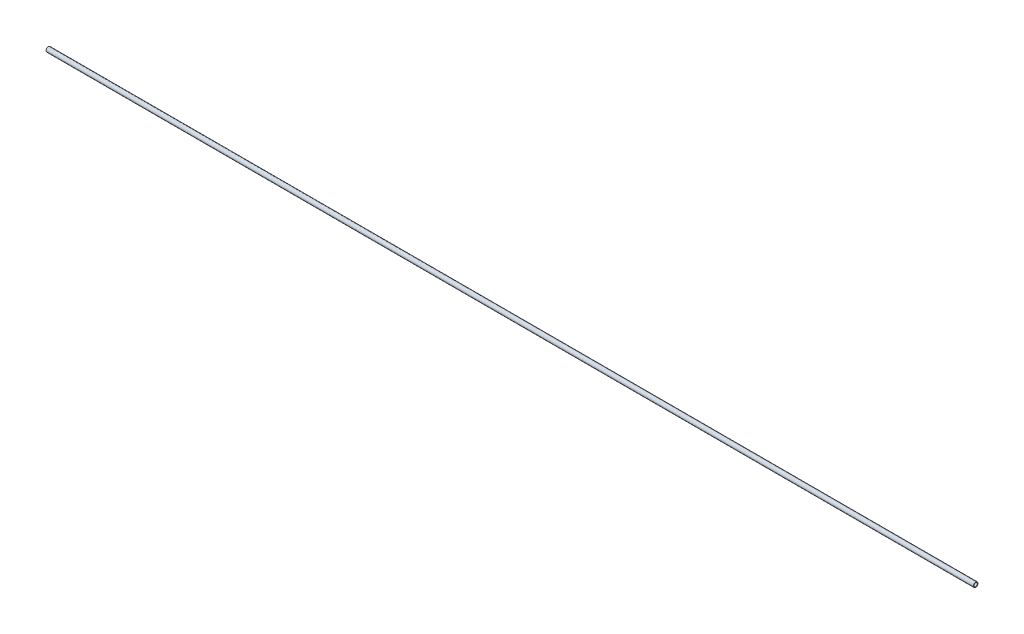
from build123d import *

# Parameters (mm, degrees)
SKETCH1_R           = 12.7
SKETCH1_R_2         = 9.652
BOSS_EXTRUDE1_DEPTH = 5080


with BuildPart() as part:
    # Sketch1 → Boss-Extrude1 (new body)
    with BuildSketch(Plane(origin=(0, 0, 0), x_dir=(0, 0, -1), z_dir=(1, 0, 0))):
        with Locations(Location((0, 0, 0), (0, 0, 180))):
            Circle(SKETCH1_R)
        with Locations(Location((0, 0, 0), (0, 0, 180))):
            Circle(SKETCH1_R_2, mode=Mode.SUBTRACT)
    extrude(amount=BOSS_EXTRUDE1_DEPTH)


solid = part.part
